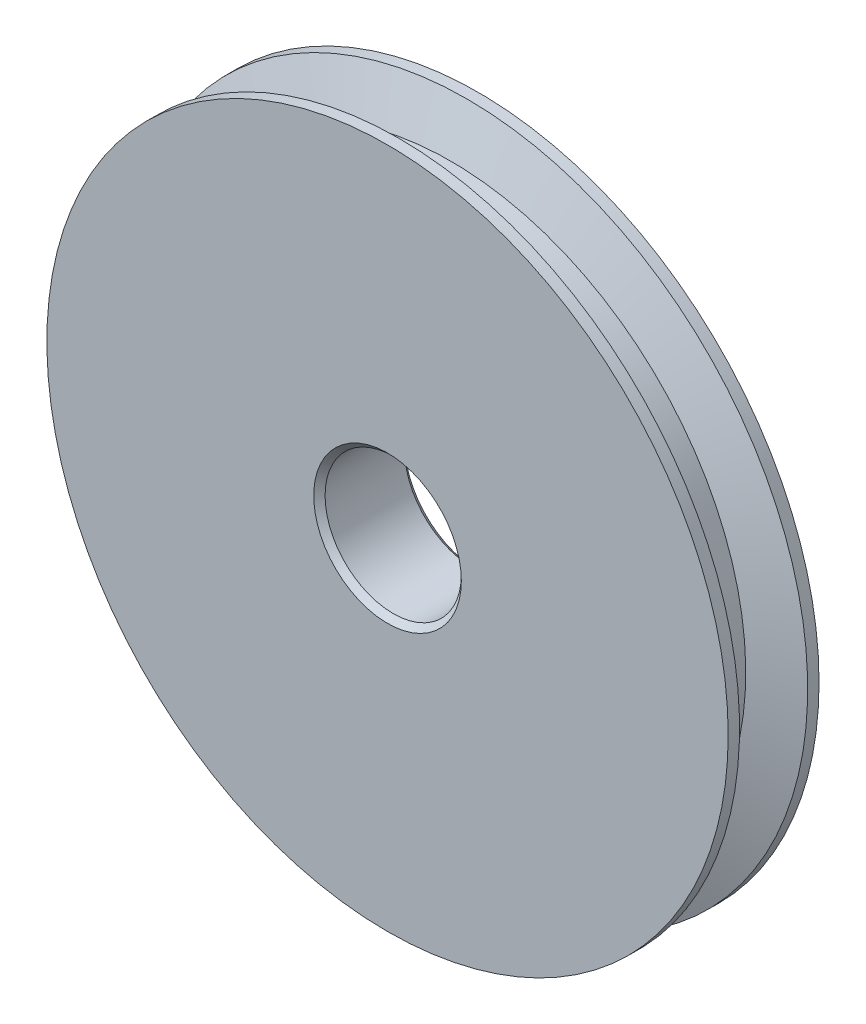
from build123d import *

# Parameters (mm, degrees)
SKETCH1_R      = 47.625
SKETCH1_R_2    = 9.525
EXTRUDE1_DEPTH = 6.35
CHAMFER1_SIZE  = 0.79375


with BuildPart() as part:
    # Sketch1 → Extrude1 (new, symmetric)
    with BuildSketch(Plane.XY):
        Circle(SKETCH1_R)
        Circle(SKETCH1_R_2, mode=Mode.SUBTRACT)
    extrude(amount=EXTRUDE1_DEPTH, both=True)

    # Chamfer1
    chamfer1_edges = [part.edges().sort_by_distance(p)[0] for p in [
        (-9.525, 0, -6.35),
        (-9.525, 0, 6.35),
    ]]
    chamfer(chamfer1_edges, length=CHAMFER1_SIZE)

    # Sketch2 → Cut-Revolve1 (revolve, cut)
    with BuildSketch(Plane(origin=(0, 0, 0), x_dir=(0, 0, -1), z_dir=(1, 0, 0)), mode=Mode.PRIVATE) as cut_revolve1_sk:
        Polygon((-4.7625, 47.625), (4.7625, 47.625), (2.451289012, 41.275), (-2.451289012, 41.275), align=None)
    revolve(cut_revolve1_sk.sketch.rotate(Axis((0, 0, 6.35), (0, 0, -1)), 180), axis=Axis((0, 0, 6.35), (0, 0, -1)), mode=Mode.SUBTRACT)


solid = part.part
